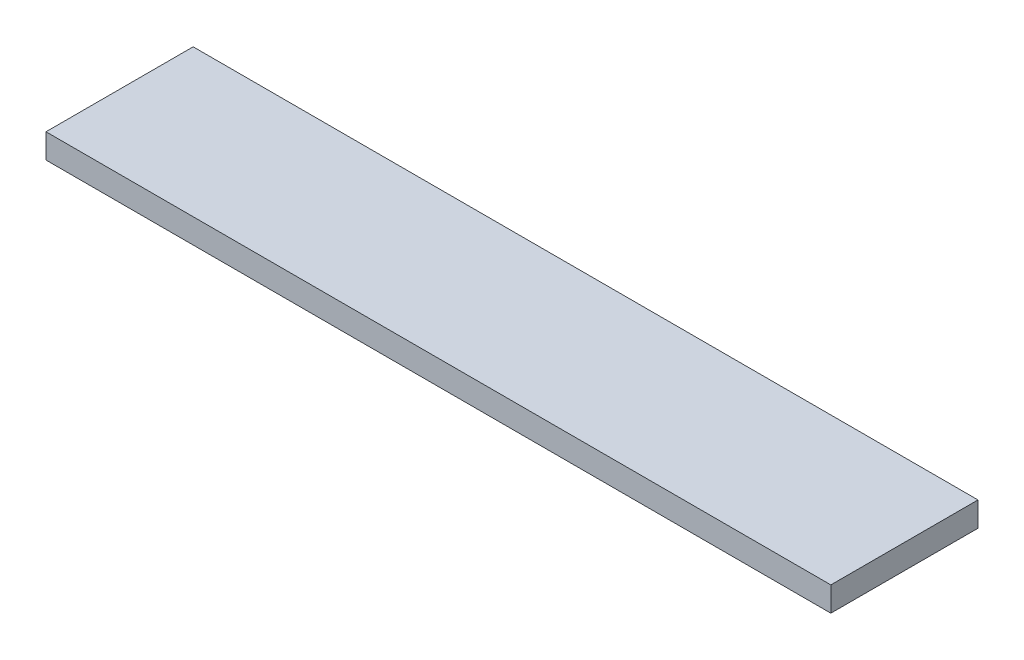
from build123d import *

# Parameters (mm, degrees)
SKETCH1_W           = 406.4
SKETCH1_H           = 12.7
BOSS_EXTRUDE1_DEPTH = 76.2


with BuildPart() as part:
    # Sketch1 → Boss-Extrude1 (new body)
    with BuildSketch(Plane.XY):
        with Locations((0, -6.35)):
            Rectangle(SKETCH1_W, SKETCH1_H)
    extrude(amount=BOSS_EXTRUDE1_DEPTH)


solid = part.part
